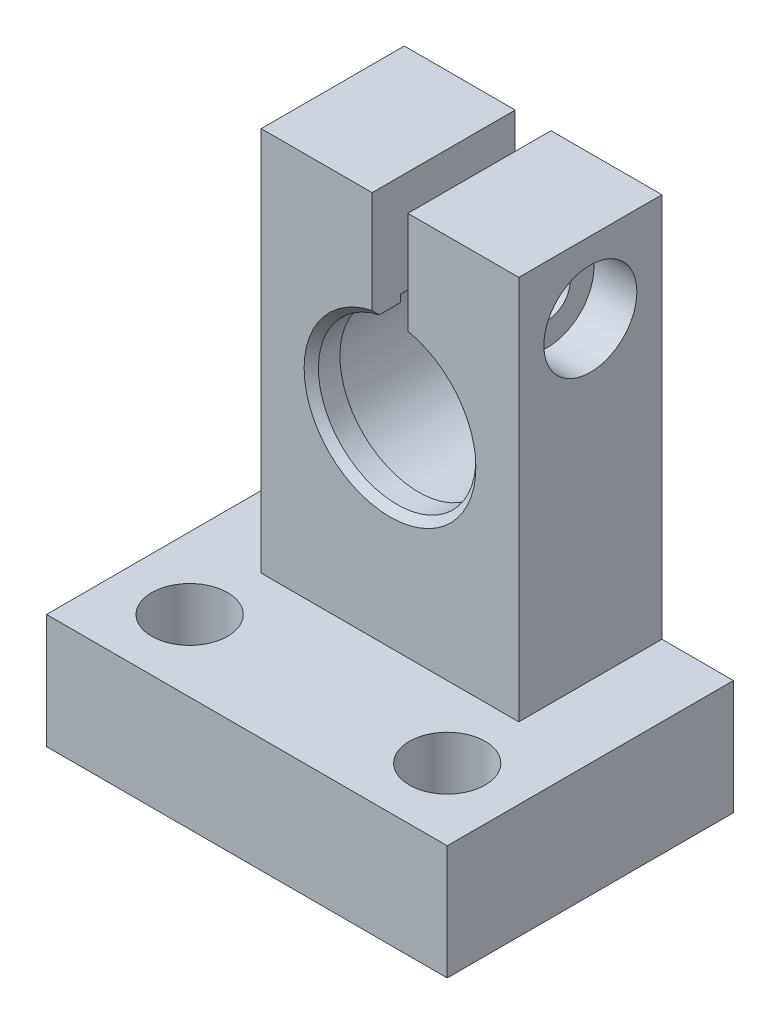
from build123d import *

# Parameters (mm, degrees)
SKETCH1_W                      = 18
SKETCH1_H                      = 34.9
SKETCH1_R                      = 6
BOSS_EXTRUDE1_DEPTH            = 10
BOSS_EXTRUDE2_START            = 2
SKETCH2_R                      = 6
SKETCH2_R_2                    = 5.5
BOSS_EXTRUDE2_DEPTH            = 2
SKETCH3_W                      = 2.5
SKETCH3_H                      = 7.643928679
CUT_EXTRUDE1_DEPTH             = 26.702334524
CBORE_FOR_M3_SHCS1_D           = 3.2
CBORE_FOR_M3_SHCS1_DEPTH       = 7.75
CBORE_FOR_M3_SHCS1_CBORE_D     = 6.5
CBORE_FOR_M3_SHCS1_CBORE_DEPTH = 3
TAP_DRILL_FOR_M3X0_5_TAP1_D    = 2.5
CHAMFER1_SIZE                  = 0.5
SKETCH11_W                     = 10
SKETCH11_H                     = 8
BOSS_EXTRUDE4_DEPTH            = 5
SKETCH8_W                      = 28
SKETCH8_H                      = 10
BOSS_EXTRUDE3_DEPTH            = 8
M5_CLEARANCE_HOLE1_D           = 5.3


with BuildPart() as part:
    # Sketch1 → Boss-Extrude1 (new body)
    with BuildSketch(Plane.XY):
        with Locations((0, -4.45)):
            Rectangle(SKETCH1_W, SKETCH1_H)
        Circle(SKETCH1_R, mode=Mode.SUBTRACT)
    extrude(amount=BOSS_EXTRUDE1_DEPTH)

    # Sketch2 → Boss-Extrude2 (add)
    with BuildSketch(Plane(origin=(0, 0, 10), x_dir=(-1, 0, 0), z_dir=(0, 0, -1)).offset(BOSS_EXTRUDE2_START)):
        Circle(SKETCH2_R)
        Circle(SKETCH2_R_2, mode=Mode.SUBTRACT)
    extrude(amount=-BOSS_EXTRUDE2_DEPTH)

    # Sketch3 → Cut-Extrude1 (cut, through all)
    with BuildSketch(Plane.XY.offset(10)):
        with Locations((0, 9.178035661)):
            Rectangle(SKETCH3_W, SKETCH3_H)
    extrude(amount=-CUT_EXTRUDE1_DEPTH, mode=Mode.SUBTRACT)

    # CBORE for M3 SHCS1
    with Locations(Plane(origin=(9, 0, 0), x_dir=(0, 0, -1), z_dir=(1, 0, 0))):
        with Locations((-5, 8)):
            CounterBoreHole(CBORE_FOR_M3_SHCS1_D / 2, CBORE_FOR_M3_SHCS1_CBORE_D / 2, CBORE_FOR_M3_SHCS1_CBORE_DEPTH, depth=CBORE_FOR_M3_SHCS1_DEPTH)

    # Tap Drill for M3x0.5 Tap1 (through all)
    with Locations(Plane.ZY.offset(9)):
        with Locations((5, 8)):
            Hole(TAP_DRILL_FOR_M3X0_5_TAP1_D / 2)

    # Chamfer1
    chamfer1_edges = [part.edges().sort_by_distance(p)[0] for p in [
        (0, -5.5, 10),
        (0, -6, 0),
    ]]
    chamfer(chamfer1_edges, length=CHAMFER1_SIZE)

    # Sketch11 → Boss-Extrude4 (add)
    with BuildSketch(Plane.ZY.offset(9)):
        with Locations((5, -17.9)):
            Rectangle(SKETCH11_W, SKETCH11_H)
    boss_extrude4 = extrude(amount=BOSS_EXTRUDE4_DEPTH)

    # Mirror1: Boss-Extrude4 across plane
    add(boss_extrude4.mirror(Plane(origin=(0, 0, 0), x_dir=(0, 0, 1), z_dir=(1, 0, 0))))

    # Sketch8 → Boss-Extrude3 (add)
    with BuildSketch(Plane.XZ.offset(21.9)):
        with Locations((0, 15)):
            Rectangle(SKETCH8_W, SKETCH8_H)
    extrude(amount=-BOSS_EXTRUDE3_DEPTH)

    # M5 Clearance Hole1 (through all)
    with Locations(Plane(origin=(0, -13.9, 0), x_dir=(1, 0, 0), z_dir=(0, 1, 0))):
        with Locations((-9, -15), (9, -15)):
            Hole(M5_CLEARANCE_HOLE1_D / 2)


solid = part.part
